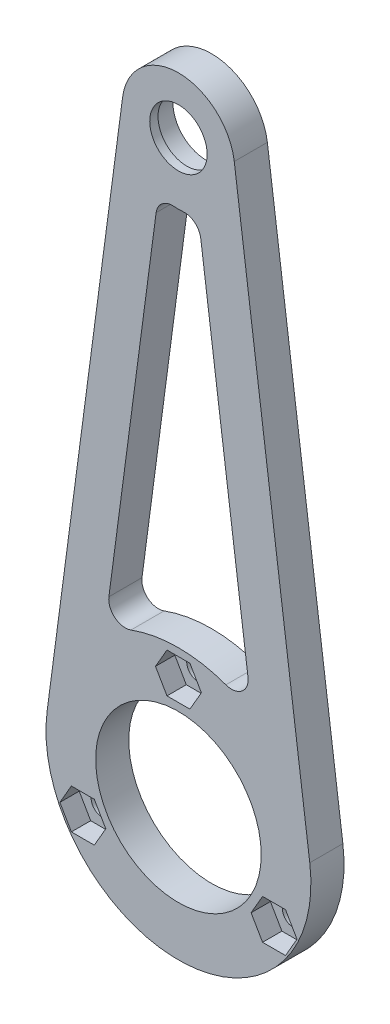
from build123d import *

# Parameters (mm, degrees)
SKETCH_1_R          = 15
SKETCH_1_R_2        = 2
SKETCH_1_R_3        = 5.2
EXTRUDE_1_DEPTH     = 6
FILLET_1_R          = 3
CUT_EXTRUDE_1_DEPTH = 3.5
SKETCH_3_R          = 6
CUT_EXTRUDE_2_DEPTH = 4.5
SKETCH_4_R          = 7.5
CUT_EXTRUDE_3_DEPTH = 1


with BuildPart() as part:
    # 草图1 → 凸台-拉伸1 (new body)
    with BuildSketch(Plane.XY):
        with BuildLine():
            Line((-23.791815434, 3.154285714), (-10.111521559, 106.340571429))
            ThreePointArc((-10.111521559, 106.340571429), (0, 115.2), (10.111521559, 106.340571429))
            Line((10.111521559, 106.340571429), (23.791815434, 3.154285714))
            ThreePointArc((23.791815434, 3.154285714), (0, -24), (-23.791815434, 3.154285714))
        make_face()
        Circle(SKETCH_1_R, mode=Mode.SUBTRACT)
        with Locations((0, 20)):
            Circle(SKETCH_1_R_2, mode=Mode.SUBTRACT)
        with Locations((0, 105)):
            Circle(SKETCH_1_R_3, mode=Mode.SUBTRACT)
        with Locations((17.320508076, -10)):
            Circle(SKETCH_1_R_2, mode=Mode.SUBTRACT)
        with Locations((-17.320508076, -10)):
            Circle(SKETCH_1_R_2, mode=Mode.SUBTRACT)
        with BuildLine():
            Line((-13.336549876, 21.1456009), (-3.624239112, 94.402599807))
            ThreePointArc((-3.624239112, 94.402599807), (0, 93.8), (3.624239112, 94.402599807))
            Line((3.624239112, 94.402599807), (13.336549876, 21.1456009))
            ThreePointArc((13.336549876, 21.1456009), (0, 25), (-13.336549876, 21.1456009))
        make_face(mode=Mode.SUBTRACT)
    extrude(amount=EXTRUDE_1_DEPTH)

    # 圆角1
    fillet_1_edges = [part.edges().sort_by_distance(p)[0] for p in [
        (-13.336549876, 21.1456009, 3),
        (13.336549876, 21.1456009, 3),
        (3.624239112, 94.402599807, 3),
        (-3.624239112, 94.402599807, 3),
    ]]
    fillet(fillet_1_edges, radius=FILLET_1_R)

    # 草图2 → 切除-拉伸1 (cut)
    with BuildSketch(Plane.XY.offset(6)):
        Polygon((2.078460969, 16.4), (4.156921938, 20), (2.078460969, 23.6), (-2.078460969, 23.6), (-4.156921938, 20), (-2.078460969, 16.4), align=None)
        Polygon((19.398969045, -13.6), (21.477430014, -10), (19.398969045, -6.4), (15.242047107, -6.4), (13.163586138, -10), (15.242047107, -13.6), align=None)
        Polygon((-15.242047107, -13.6), (-13.163586138, -10), (-15.242047107, -6.4), (-19.398969045, -6.4), (-21.477430014, -10), (-19.398969045, -13.6), align=None)
    extrude(amount=-CUT_EXTRUDE_1_DEPTH, mode=Mode.SUBTRACT)

    # 草图3 → 切除-拉伸2 (cut)
    with BuildSketch(Plane(origin=(0, 0, 0), x_dir=(-1, 0, 0), z_dir=(0, 0, -1))):
        with Locations((0, 105)):
            Circle(SKETCH_3_R)
    extrude(amount=-CUT_EXTRUDE_2_DEPTH, mode=Mode.SUBTRACT)

    # 草图4 → 切除-拉伸3 (cut)
    with BuildSketch(Plane(origin=(0, 0, 0), x_dir=(-1, 0, 0), z_dir=(0, 0, -1))):
        with Locations((0, 105)):
            Circle(SKETCH_4_R)
    extrude(amount=-CUT_EXTRUDE_3_DEPTH, mode=Mode.SUBTRACT)


solid = part.part
